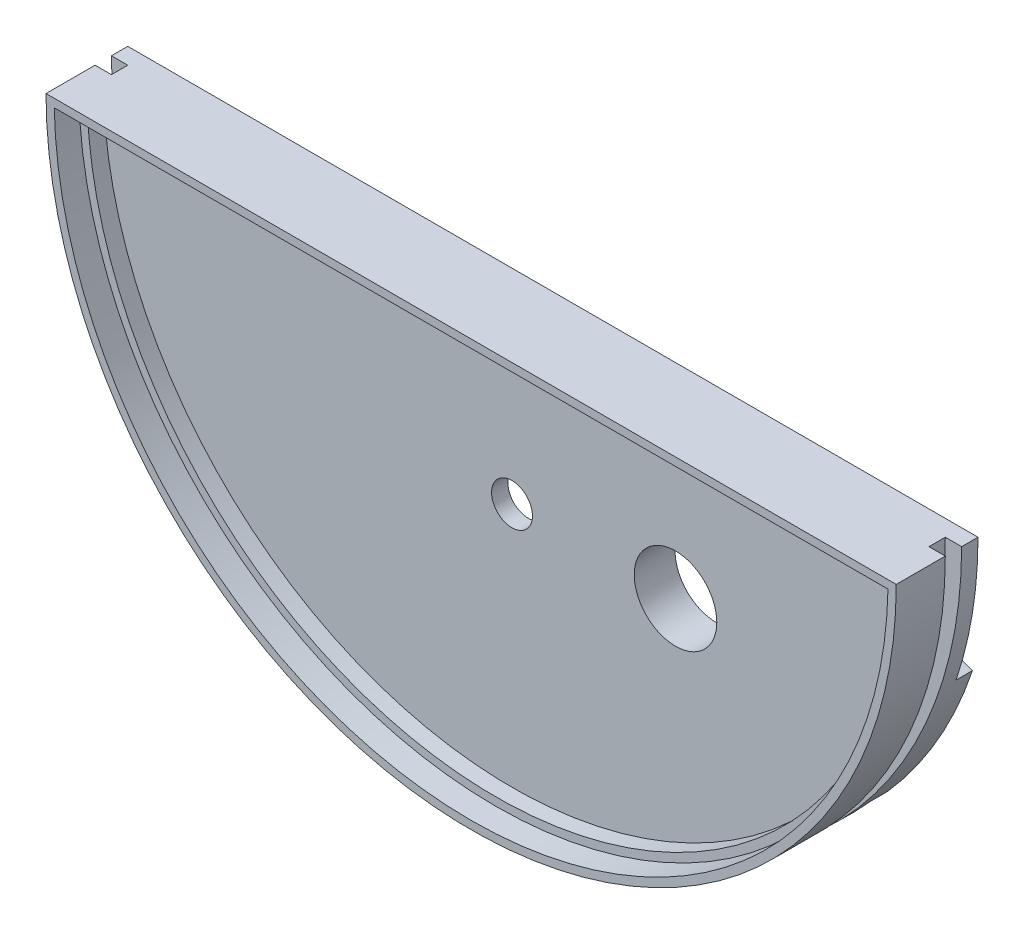
from build123d import *

# Parameters (mm, degrees)
SKETCH1_R           = 5.05
BOSS_EXTRUDE1_DEPTH = 5
BOSS_EXTRUDE2_START = 5
BOSS_EXTRUDE2_DEPTH = 5
BOSS_EXTRUDE4_DEPTH = 2
CUT_EXTRUDE1_START  = -3
SKETCH6_R           = 9.5
SKETCH6_R_2         = 5.05
CUT_EXTRUDE1_DEPTH  = 3
SKETCH7_R           = 2.5
CUT_EXTRUDE2_DEPTH  = 74.87151007
SKETCH8_R           = 5
BOSS_EXTRUDE5_DEPTH = 3
CUT_EXTRUDE3_DEPTH  = 3
SKETCH10_W          = 8.596273884
SKETCH10_H          = 2
CUT_REVOLVE1_ANGLE  = 180


with BuildPart() as part:
    # Sketch1 → Boss-Extrude1 (new body)
    with BuildSketch(Plane.XY):
        with BuildLine():
            Line((-52, 0), (52, 0))
            ThreePointArc((52, 0), (0, -52), (-52, 0))
        make_face()
        with Locations((20, -20)):
            Circle(SKETCH1_R, mode=Mode.SUBTRACT)
    extrude(amount=-BOSS_EXTRUDE1_DEPTH)

    # Sketch2 → Boss-Extrude2 (add)
    with BuildSketch(Plane.XY.offset(BOSS_EXTRUDE2_START)):
        with BuildLine():
            Line((52, 0), (-52, 0))
            ThreePointArc((-52, 0), (0, -52), (52, 0))
        make_face()
        with BuildLine():
            Line((49.959983987, -2), (-49.959983987, -2))
            ThreePointArc((-49.959983987, -2), (0, -50), (49.959983987, -2))
        make_face(mode=Mode.SUBTRACT)
    extrude(amount=-BOSS_EXTRUDE2_DEPTH)

    # Sketch5 → Boss-Extrude4 (add)
    with BuildSketch(Plane(origin=(0, 0, -5), x_dir=(-1, 0, 0), z_dir=(0, 0, -1))):
        with BuildLine():
            ThreePointArc((-49.323463146, -16.468029126), (-45.033320997, -26), (-38.923463146, -34.481357524))
            Line((-38.923463146, -34.481357524), (-37.426406871, -33.155151466))
            ThreePointArc((-37.426406871, -33.155151466), (-43.301270189, -25), (-47.426406871, -15.83464339))
            Line((-47.426406871, -15.83464339), (-49.323463146, -16.468029126))
        make_face()
        with BuildLine():
            Line((10.4, -50.94938665), (10, -48.989794856))
            ThreePointArc((10, -48.989794856), (0, -50), (-10, -48.989794856))
            Line((-10, -48.989794856), (-10.4, -50.94938665))
            ThreePointArc((-10.4, -50.94938665), (0, -52), (10.4, -50.94938665))
        make_face()
        with BuildLine():
            Line((37.426406871, -33.155151466), (38.923463146, -34.481357524))
            ThreePointArc((38.923463146, -34.481357524), (45.033320997, -26), (49.323463146, -16.468029126))
            Line((49.323463146, -16.468029126), (47.426406871, -15.83464339))
            ThreePointArc((47.426406871, -15.83464339), (43.301270189, -25), (37.426406871, -33.155151466))
        make_face()
    extrude(amount=BOSS_EXTRUDE4_DEPTH)

    # Sketch6 → Cut-Extrude1 (cut)
    with BuildSketch(Plane(origin=(0, 0, -5), x_dir=(-1, 0, 0), z_dir=(0, 0, -1)).offset(CUT_EXTRUDE1_START)):
        with Locations((0, -20)):
            Circle(SKETCH6_R)
        with Locations(Location((-20, -20, 0), (0, 0, 180))):
            Circle(SKETCH6_R_2)
    extrude(amount=CUT_EXTRUDE1_DEPTH, mode=Mode.SUBTRACT)

    # Sketch7 → Cut-Extrude2 (cut, through all)
    with BuildSketch(Plane(origin=(0, 0, -2), x_dir=(-1, 0, 0), z_dir=(0, 0, -1))):
        with Locations((0, -20)):
            Circle(SKETCH7_R)
    extrude(amount=-CUT_EXTRUDE2_DEPTH, mode=Mode.SUBTRACT)

    # Sketch8 → Boss-Extrude5 (add)
    with BuildSketch(Plane(origin=(0, 0, -5), x_dir=(-1, 0, 0), z_dir=(0, 0, -1))):
        with Locations(Location((20, -20, 0), (0, 0, 180))):
            Circle(SKETCH8_R)
    extrude(amount=BOSS_EXTRUDE5_DEPTH)

    # Sketch9 → Cut-Extrude3 (cut)
    # profile 1 of 2: a face of its own
    with BuildSketch(Plane.XY.offset(5)):
        with BuildLine():
            Line((50.990195136, -1), (-50.990195136, -1))
            ThreePointArc((-50.990195136, -1), (0, -51), (50.990195136, -1))
        make_face()
        with BuildLine():
            ThreePointArc((49.959983987, -2), (0, -50), (-49.959983987, -2))
            Line((-49.959983987, -2), (49.959983987, -2))
        make_face(mode=Mode.SUBTRACT)
    # profile 2 of 2: a face of its own
    with BuildSketch(Plane.XY.offset(5)):
        with BuildLine():
            Line((-49.959983987, -2), (49.959983987, -2))
            ThreePointArc((49.959983987, -2), (0, -50), (-49.959983987, -2))
        make_face()
    extrude(amount=-CUT_EXTRUDE3_DEPTH, mode=Mode.SUBTRACT)

    # Sketch10 → Cut-Revolve1 (revolve, cut)
    with BuildSketch(Plane(origin=(0, 0, 0), x_dir=(1, 0, 0), z_dir=(0, 1, 0))):
        with Locations((54.298136942, 2)):
            Rectangle(SKETCH10_W, SKETCH10_H)
    revolve(axis=Axis((0, 0, -7.000025), (0, 0, -1)), revolution_arc=CUT_REVOLVE1_ANGLE, mode=Mode.SUBTRACT)


solid = part.part
